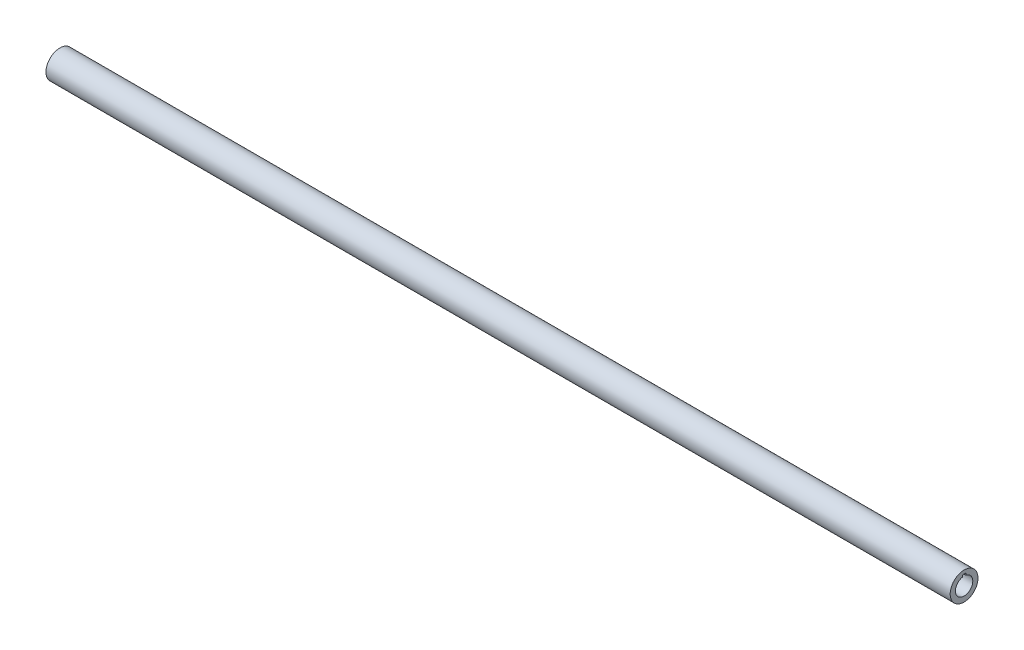
from build123d import *

# Parameters (mm, degrees)
SKETCH1_R           = 60.96
BOSS_EXTRUDE1_DEPTH = 3962.4
SKETCH2_R           = 38.1
CUT_EXTRUDE1_DEPTH  = 304.8
SKETCH3_W           = 15.24
SKETCH3_H           = 15.24
CUT_EXTRUDE2_DEPTH  = 304.8
CUT_EXTRUDE3_START  = -304.8
SKETCH4_R           = 38.1
CUT_EXTRUDE3_DEPTH  = 304.8
SKETCH5_W           = 15.24
SKETCH5_H           = 15.24
CUT_EXTRUDE4_DEPTH  = 304.8


with BuildPart() as part:
    # Sketch1 → Boss-Extrude1 (new body)
    with BuildSketch(Plane(origin=(0, 0, 0), x_dir=(0, 0, -1), z_dir=(1, 0, 0))):
        Circle(SKETCH1_R)
    extrude(amount=BOSS_EXTRUDE1_DEPTH)

    # Sketch2 → Cut-Extrude1 (cut)
    with BuildSketch(Plane.ZY):
        Circle(SKETCH2_R)
    extrude(amount=-CUT_EXTRUDE1_DEPTH, mode=Mode.SUBTRACT)

    # Sketch3 → Cut-Extrude2 (cut)
    with BuildSketch(Plane.ZY):
        with Locations((0, 38.1)):
            Rectangle(SKETCH3_W, SKETCH3_H)
    extrude(amount=-CUT_EXTRUDE2_DEPTH, mode=Mode.SUBTRACT)

    # Sketch4 → Cut-Extrude3 (cut)
    with BuildSketch(Plane(origin=(3962.4, 0, 0), x_dir=(0, 0, -1), z_dir=(1, 0, 0)).offset(CUT_EXTRUDE3_START)):
        Circle(SKETCH4_R)
    extrude(amount=CUT_EXTRUDE3_DEPTH, mode=Mode.SUBTRACT)

    # Sketch5 → Cut-Extrude4 (cut)
    with BuildSketch(Plane(origin=(3962.4, 0, 0), x_dir=(0, 0, -1), z_dir=(1, 0, 0))):
        with Locations((0, 38.1)):
            Rectangle(SKETCH5_W, SKETCH5_H)
    extrude(amount=-CUT_EXTRUDE4_DEPTH, mode=Mode.SUBTRACT)


solid = part.part
